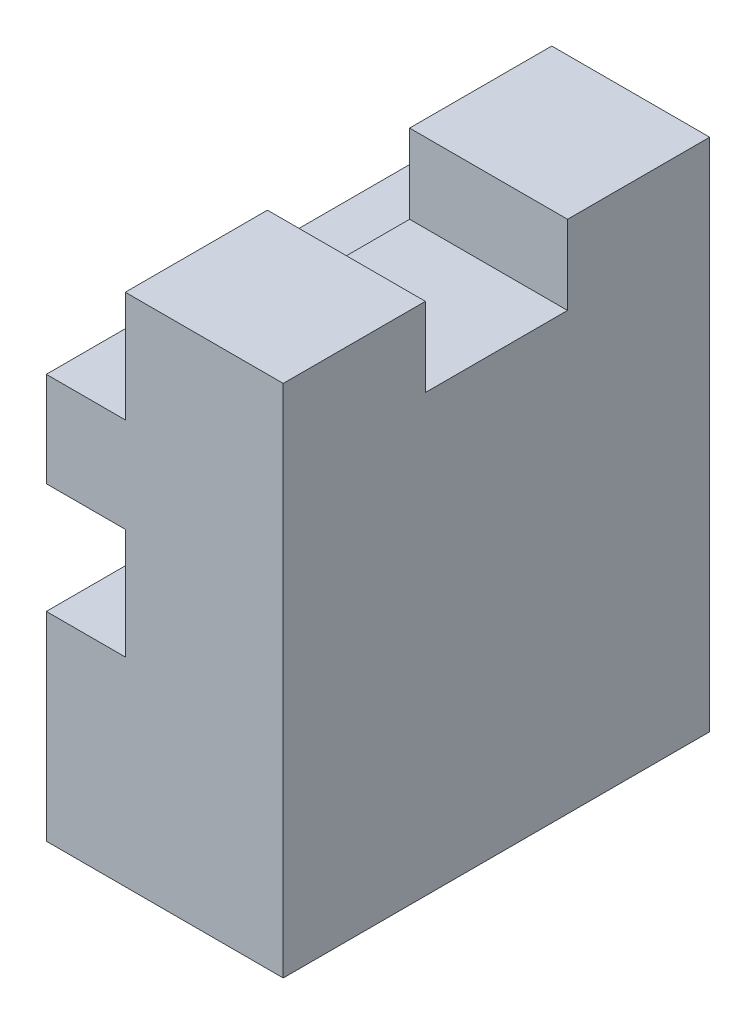
from build123d import *

# Parameters (mm, degrees)
EXTRUDE_1_DEPTH     = 27
SKETCH_2_W          = 10
SKETCH_2_H          = 9
CUT_EXTRUDE_1_DEPTH = 5


with BuildPart() as part:
    # 草图1 → 凸台-拉伸1 (new body)
    with BuildSketch(Plane.XY):
        Polygon((0, 0), (10, 0), (10, -32.6), (-5, -32.6), (-5, -20), (0, -20), (0, -13), (-5, -13), (-5, -7), (0, -7), align=None)
    extrude(amount=EXTRUDE_1_DEPTH)

    # 草图2 → 切除-拉伸1 (cut)
    with BuildSketch(Plane(origin=(0, 0, 0), x_dir=(1, 0, 0), z_dir=(0, 1, 0))):
        with Locations((5, -13.5)):
            Rectangle(SKETCH_2_W, SKETCH_2_H)
    extrude(amount=-CUT_EXTRUDE_1_DEPTH, mode=Mode.SUBTRACT)


solid = part.part
